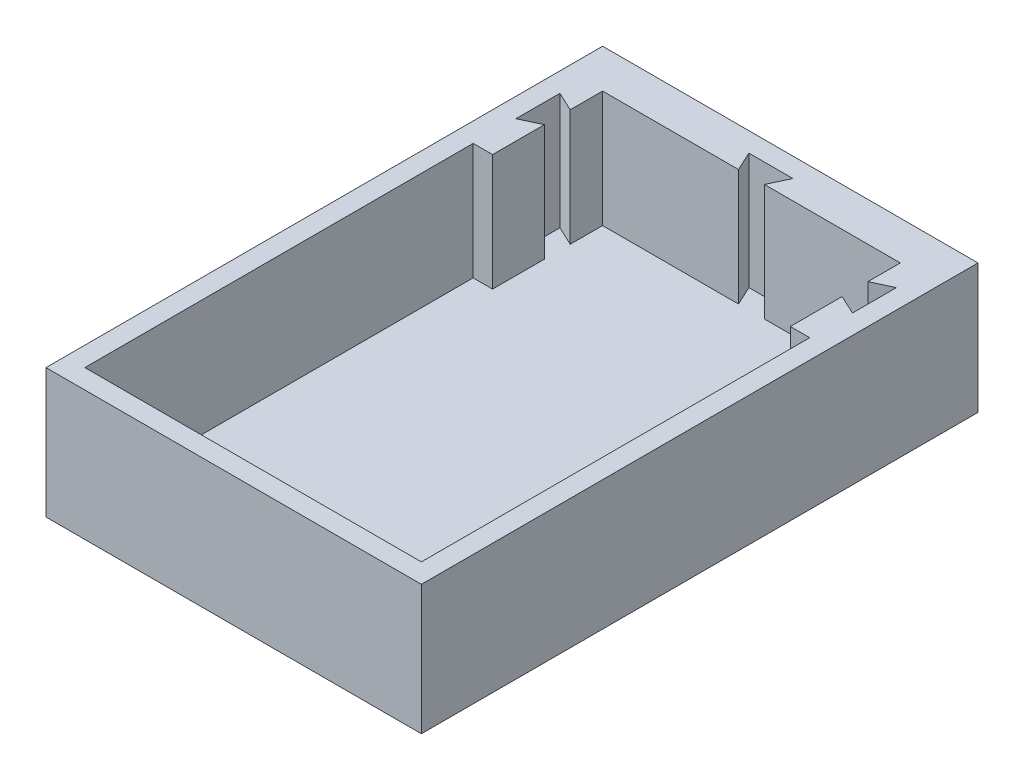
from build123d import *

# Parameters (mm, degrees)
SKETCH1_W          = 66.04
SKETCH1_H          = 101.6
BASE_EXTRUDE_DEPTH = 2.54
SKETCH2_W          = 73.66
SKETCH2_H          = 109.22
SKETCH2_W_2        = 66.04
SKETCH2_H_2        = 101.6
WALLS_DEPTH        = 25.4
BUTTON_GUIDE_DEPTH = 22.86


with BuildPart() as part:
    # Sketch1 → Base Extrude (new body)
    with BuildSketch(Plane(origin=(0, 0, 0), x_dir=(1, 0, 0), z_dir=(0, 1, 0))):
        with Locations((33.02, 50.8)):
            Rectangle(SKETCH1_W, SKETCH1_H)
    extrude(amount=BASE_EXTRUDE_DEPTH)

    # Sketch2 → Walls (add)
    with BuildSketch(Plane.XZ):
        with Locations((33.02, -50.8)):
            Rectangle(SKETCH2_W, SKETCH2_H)
        with Locations((33.02, -50.8)):
            Rectangle(SKETCH2_W_2, SKETCH2_H_2, mode=Mode.SUBTRACT)
    extrude(amount=-WALLS_DEPTH)

    # Sketch3 → Button Guide (add)
    with BuildSketch(Plane(origin=(0, 25.4, 0), x_dir=(1, 0, 0), z_dir=(0, 1, 0))):
        Polygon((3.81, 86.36), (0, 84.583367822), (0, 76.2), (3.81, 76.2), align=None)
        Polygon((28.703367822, 101.6), (0, 101.6), (0, 93.216632178), (3.81, 91.44), (3.81, 97.79), (30.48, 97.79), align=None)
        Polygon((66.04, 101.6), (37.336632178, 101.6), (35.56, 97.79), (62.23, 97.79), (62.23, 91.44), (66.04, 93.216632178), align=None)
        Polygon((66.04, 76.2), (66.04, 84.583367822), (62.23, 86.36), (62.23, 76.2), align=None)
    extrude(amount=-BUTTON_GUIDE_DEPTH)


solid = part.part
